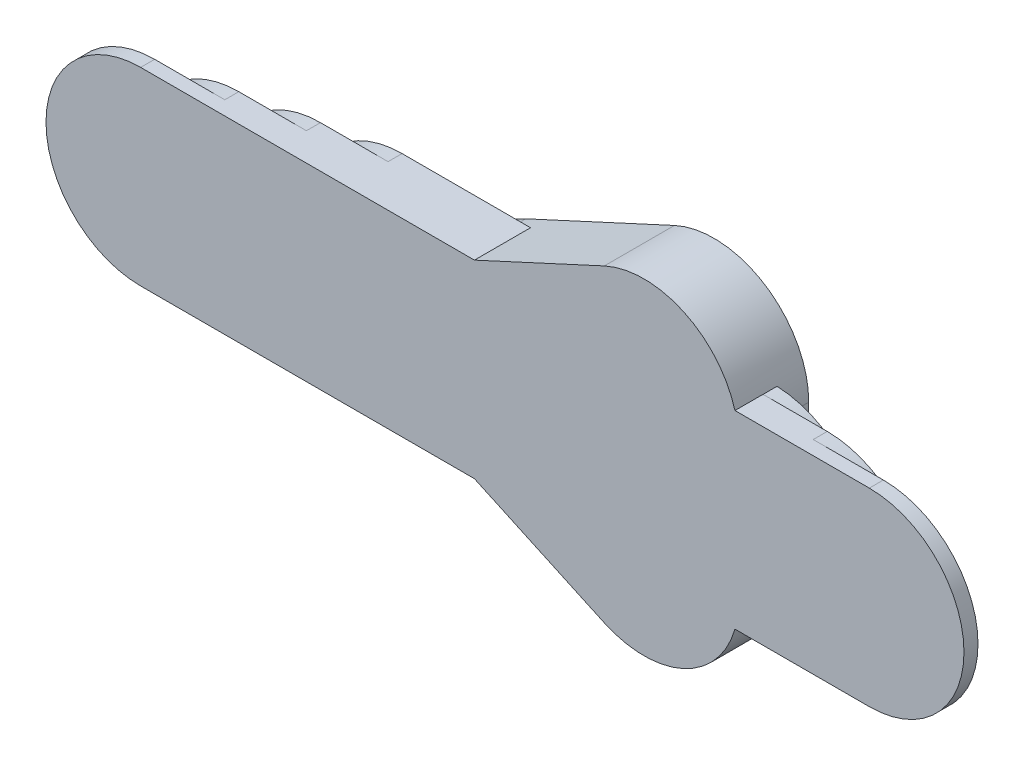
from build123d import *

# Parameters (mm, degrees)
BOSS_EXTRUDE1_DEPTH = 2.8
BOSS_EXTRUDE5_DEPTH = 2.8
BOSS_EXTRUDE2_DEPTH = 2.8
BOSS_EXTRUDE3_DEPTH = 2.8
BOSS_EXTRUDE4_DEPTH = 2.8
BOSS_EXTRUDE6_DEPTH = 11.2
BOSS_EXTRUDE7_START = -2.8
BOSS_EXTRUDE7_DEPTH = 2.8


with BuildPart() as part:
    # Sketch1 → Boss-Extrude1 (new body)
    with BuildSketch(Plane.XY):
        with BuildLine():
            Line((-31.75, 18.9), (31.75, 18.9))
            ThreePointArc((31.75, 18.9), (50.65, 0), (31.75, -18.9))
            Line((31.75, -18.9), (-31.75, -18.9))
            ThreePointArc((-31.75, -18.9), (-50.65, 0), (-31.75, 18.9))
        make_face()
    extrude(amount=BOSS_EXTRUDE1_DEPTH)

    # Sketch5 → Boss-Extrude5 (add)
    with BuildSketch(Plane(origin=(0, 0, 0), x_dir=(-1, 0, 0), z_dir=(0, 0, -1))):
        with BuildLine():
            Line((-46.65, -13.7), (-46.65, 13.7))
            ThreePointArc((-46.65, 13.7), (-37.937921505, 29.619053219), (-19.833465037, 30.862123242))
            Line((-19.833465037, 30.862123242), (9.866534963, 17.162123242))
            ThreePointArc((9.866534963, 17.162123242), (20.85, 0), (9.866534963, -17.162123242))
            Line((9.866534963, -17.162123242), (-19.833465037, -30.862123242))
            ThreePointArc((-19.833465037, -30.862123242), (-37.937921505, -29.619053219), (-46.65, -13.7))
        make_face()
    extrude(amount=BOSS_EXTRUDE5_DEPTH)

    # Sketch2 → Boss-Extrude2 (add)
    with BuildSketch(Plane.XY.offset(2.8)):
        with BuildLine():
            Line((-45.25, 18.9), (45.25, 18.9))
            ThreePointArc((45.25, 18.9), (64.15, 0), (45.25, -18.9))
            Line((45.25, -18.9), (-45.25, -18.9))
            ThreePointArc((-45.25, -18.9), (-64.15, 0), (-45.25, 18.9))
        make_face()
    extrude(amount=BOSS_EXTRUDE2_DEPTH)

    # Sketch3 → Boss-Extrude3 (add)
    with BuildSketch(Plane.XY.offset(5.6)):
        with BuildLine():
            Line((-58.75, 18.9), (58.75, 18.9))
            ThreePointArc((58.75, 18.9), (77.65, 0), (58.75, -18.9))
            Line((58.75, -18.9), (-58.75, -18.9))
            ThreePointArc((-58.75, -18.9), (-77.65, 0), (-58.75, 18.9))
        make_face()
    extrude(amount=BOSS_EXTRUDE3_DEPTH)

    # Sketch4 → Boss-Extrude4 (add)
    with BuildSketch(Plane.XY.offset(8.4)):
        with BuildLine():
            Line((-72.75, 18.9), (72.75, 18.9))
            ThreePointArc((72.75, 18.9), (91.65, 0), (72.75, -18.9))
            Line((72.75, -18.9), (-72.75, -18.9))
            ThreePointArc((-72.75, -18.9), (-91.65, 0), (-72.75, 18.9))
        make_face()
    extrude(amount=BOSS_EXTRUDE4_DEPTH)

    # Sketch7 → Boss-Extrude6 (add)
    with BuildSketch(Plane.XY):
        with BuildLine():
            Line((31.75, -18.9), (-6.099021116, -18.9))
            Line((-6.099021116, -18.9), (19.833465037, -30.862123242))
            ThreePointArc((19.833465037, -30.862123242), (37.937921505, -29.619053219), (46.65, -13.7))
            Line((46.65, -13.7), (46.65, -11.627553483))
            ThreePointArc((46.65, -11.627553483), (40.040031338, -16.984857386), (31.75, -18.9))
        make_face()
        with BuildLine():
            Line((46.65, 11.627553483), (46.65, 13.7))
            ThreePointArc((46.65, 13.7), (37.937921505, 29.619053219), (19.833465037, 30.862123242))
            Line((19.833465037, 30.862123242), (-6.099021116, 18.9))
            Line((-6.099021116, 18.9), (31.75, 18.9))
            ThreePointArc((31.75, 18.9), (40.040031338, 16.984857386), (46.65, 11.627553483))
        make_face()
    extrude(amount=BOSS_EXTRUDE6_DEPTH)

    # Sketch10 → Boss-Extrude7 (add)
    with BuildSketch(Plane(origin=(0, 0, -2.8), x_dir=(-1, 0, 0), z_dir=(0, 0, -1)).offset(BOSS_EXTRUDE7_START)):
        with BuildLine():
            ThreePointArc((18.009763314, -9.964637591), (28.85, 0), (18.009763314, 9.964637591))
            ThreePointArc((18.009763314, 9.964637591), (20.85, 0), (18.009763314, -9.964637591))
        make_face()
    extrude(amount=BOSS_EXTRUDE7_DEPTH)


solid = part.part
